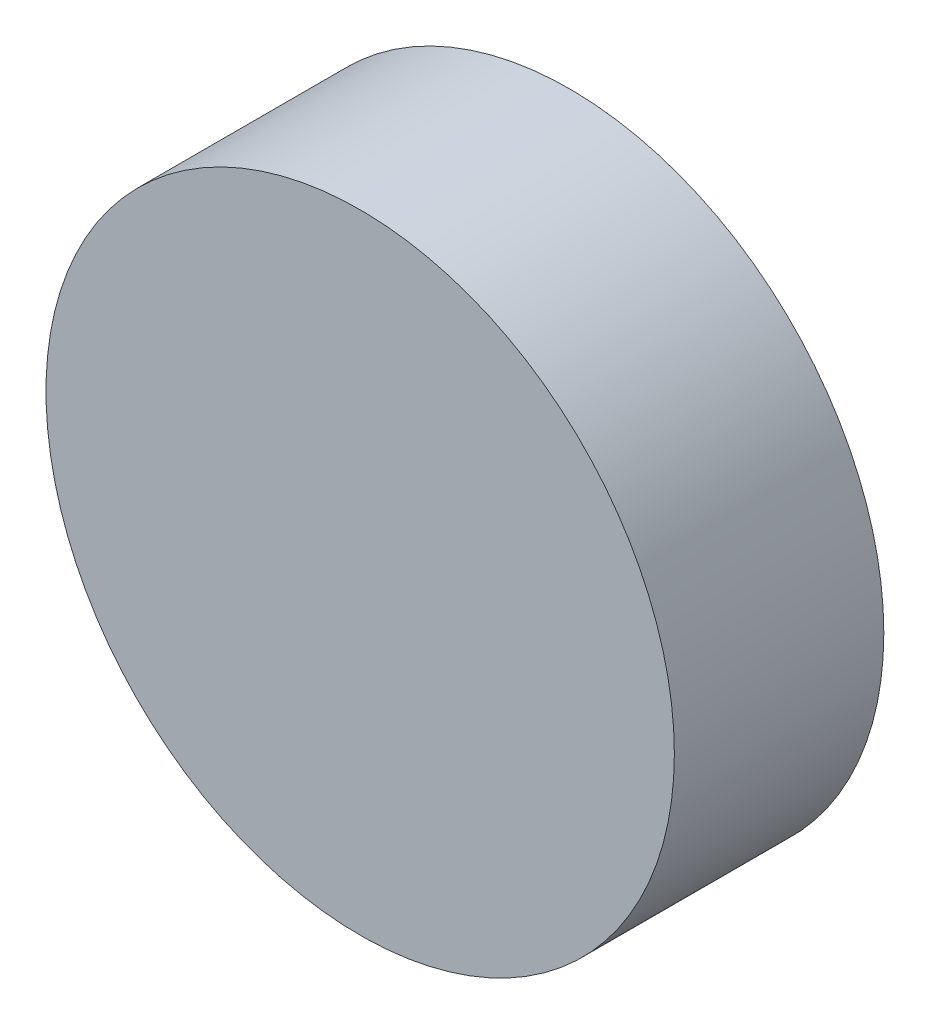
from build123d import *

# Parameters (mm, degrees)
SKETCH1_R           = 5.25
BOSS_EXTRUDE1_DEPTH = 3.5


with BuildPart() as part:
    # Sketch1 → Boss-Extrude1 (new body)
    with BuildSketch(Plane.XY):
        Circle(SKETCH1_R)
    extrude(amount=BOSS_EXTRUDE1_DEPTH)


solid = part.part
